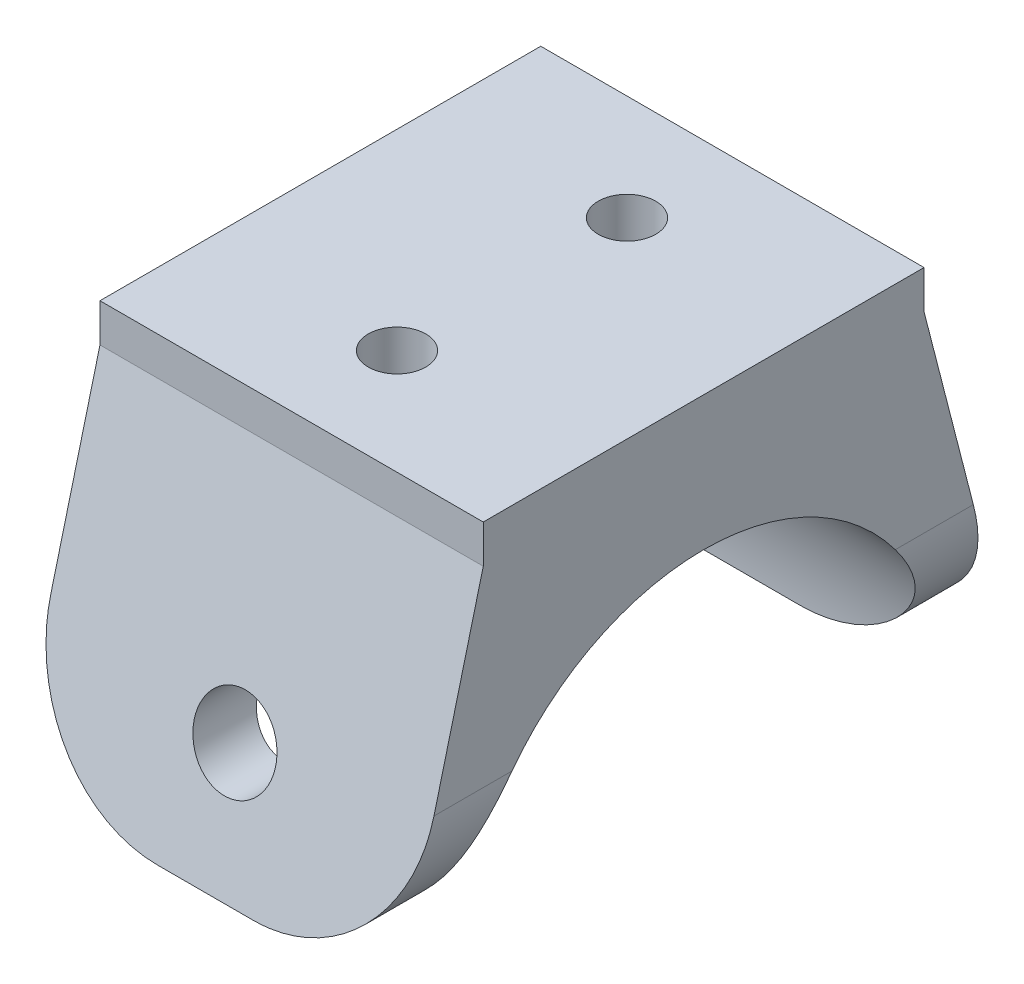
from build123d import *

# Parameters (mm, degrees)
SKETCH1_R           = 4.25
BOSS_EXTRUDE1_DEPTH = 32
CUT_EXTRUDE1_DEPTH  = 64
SKETCH3_R           = 3
CUT_EXTRUDE2_DEPTH  = 14
SKETCH4_R           = 25
CUT_EXTRUDE3_DEPTH  = 55.811039034


with BuildPart() as part:
    # Sketch1 → Boss-Extrude1 (new, symmetric)
    with BuildSketch(Plane.XY):
        with BuildLine():
            Line((-5, -19.5), (5, -19.5))
            ThreePointArc((5, -19.5), (15.606601718, -15.106601718), (20, -4.5))
            Line((20, -4.5), (20, 19.5))
            Line((20, 19.5), (-20, 19.5))
            Line((-20, 19.5), (-20, -4.5))
            ThreePointArc((-20, -4.5), (-15.606601718, -15.106601718), (-5, -19.5))
        make_face()
        with Locations((0, -7.5)):
            Circle(SKETCH1_R, mode=Mode.SUBTRACT)
    extrude(amount=BOSS_EXTRUDE1_DEPTH, both=True)

    # Sketch2 → Cut-Extrude1 (cut)
    with BuildSketch(Plane.ZY.offset(20)):
        Polygon((23, 19.5), (23, 15.5), (32, -19.5), (32, 19.5), align=None)
        Polygon((-32, 19.5), (-23, 19.5), (-23, 15.5), (-32, -19.5), align=None)
    extrude(amount=-CUT_EXTRUDE1_DEPTH, mode=Mode.SUBTRACT)

    # Sketch3 → Cut-Extrude2 (cut)
    with BuildSketch(Plane(origin=(0, 19.5, 0), x_dir=(1, 0, 0), z_dir=(0, 1, 0))):
        with Locations(Location((0, 12, 0), (0, 0, 270))):
            Circle(SKETCH3_R)
        with Locations(Location((0, -12, 0), (0, 0, 90))):
            Circle(SKETCH3_R)
    extrude(amount=-CUT_EXTRUDE2_DEPTH, mode=Mode.SUBTRACT)

    # Sketch4 → Cut-Extrude3 (cut, through all)
    with BuildSketch(Plane.ZY.offset(20)):
        with Locations((0, -19.5)):
            Circle(SKETCH4_R)
    extrude(amount=-CUT_EXTRUDE3_DEPTH, mode=Mode.SUBTRACT)


solid = part.part
